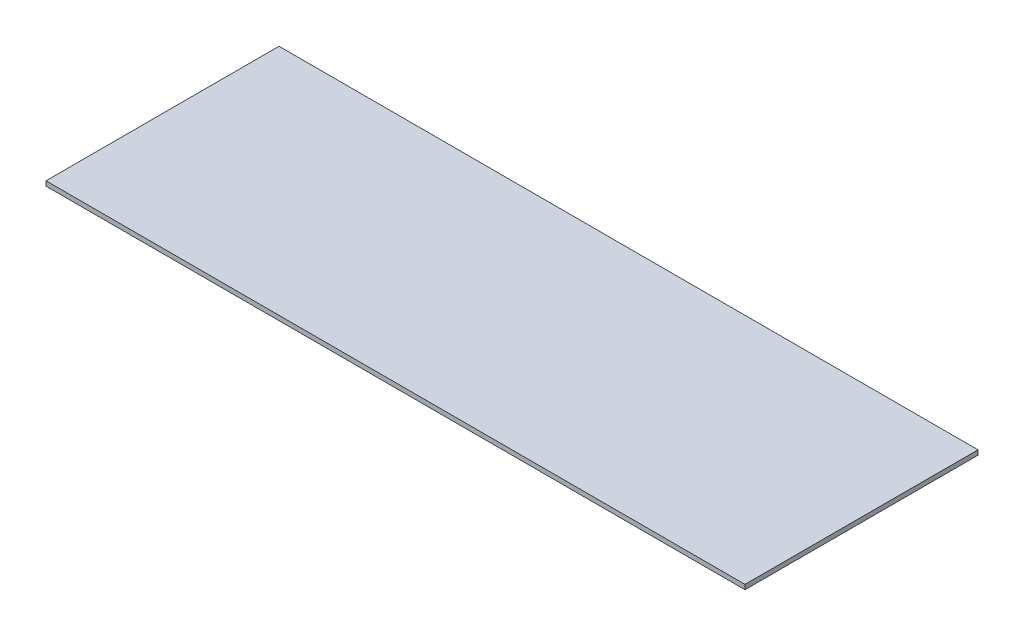
from build123d import *

# Parameters (mm, degrees)
SKETCH1_W           = 30
SKETCH1_H           = 10
BOSS_EXTRUDE1_DEPTH = 0.2


with BuildPart() as part:
    # Sketch1 → Boss-Extrude1 (new body)
    with BuildSketch(Plane(origin=(0, 0, 0), x_dir=(1, 0, 0), z_dir=(0, 1, 0))):
        Rectangle(SKETCH1_W, SKETCH1_H)
    extrude(amount=BOSS_EXTRUDE1_DEPTH)


solid = part.part
